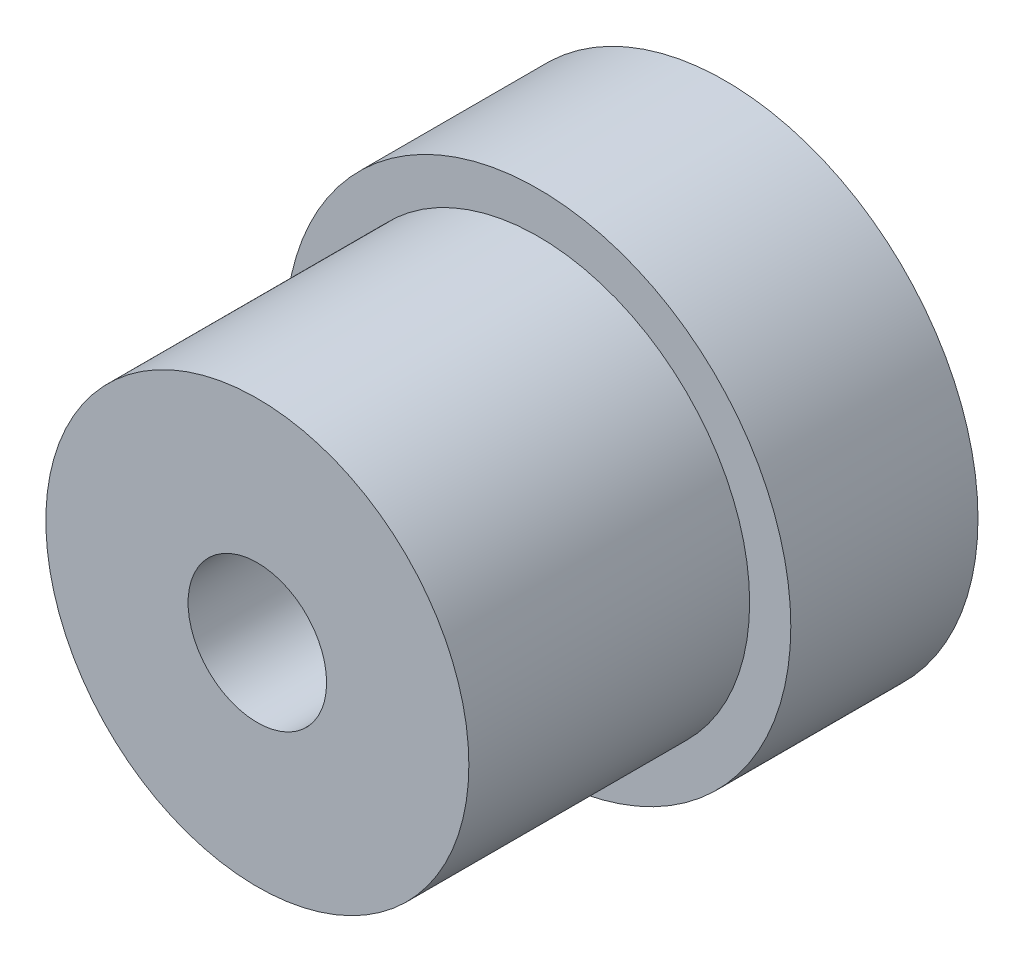
from build123d import *

# Parameters (mm, degrees)
AICAD_SKETCH_F001_R           = 13.5
AICAD_F001_BASE_EXTRUDE_DEPTH = 10
AICAD_SKETCH_F002_R           = 11.3
AICAD_F002_BOSS_EXTRUDE_DEPTH = 15
AICAD_SKETCH_F003_R           = 3.7
AICAD_F003_CUT_EXTRUDE_DEPTH  = 32.45631892


with BuildPart() as part:
    # AICAD_SKETCH_F001 → AICAD_F001_BASE_EXTRUDE (new body)
    with BuildSketch(Plane.XY):
        Circle(AICAD_SKETCH_F001_R)
    extrude(amount=AICAD_F001_BASE_EXTRUDE_DEPTH)

    # AICAD_SKETCH_F002 → AICAD_F002_BOSS_EXTRUDE (add)
    with BuildSketch(Plane.XY.offset(10)):
        Circle(AICAD_SKETCH_F002_R)
    extrude(amount=AICAD_F002_BOSS_EXTRUDE_DEPTH)

    # AICAD_SKETCH_F003 → AICAD_F003_CUT_EXTRUDE (cut, through all)
    with BuildSketch(Plane.XY.offset(25)):
        Circle(AICAD_SKETCH_F003_R)
    extrude(amount=-AICAD_F003_CUT_EXTRUDE_DEPTH, mode=Mode.SUBTRACT)


solid = part.part
